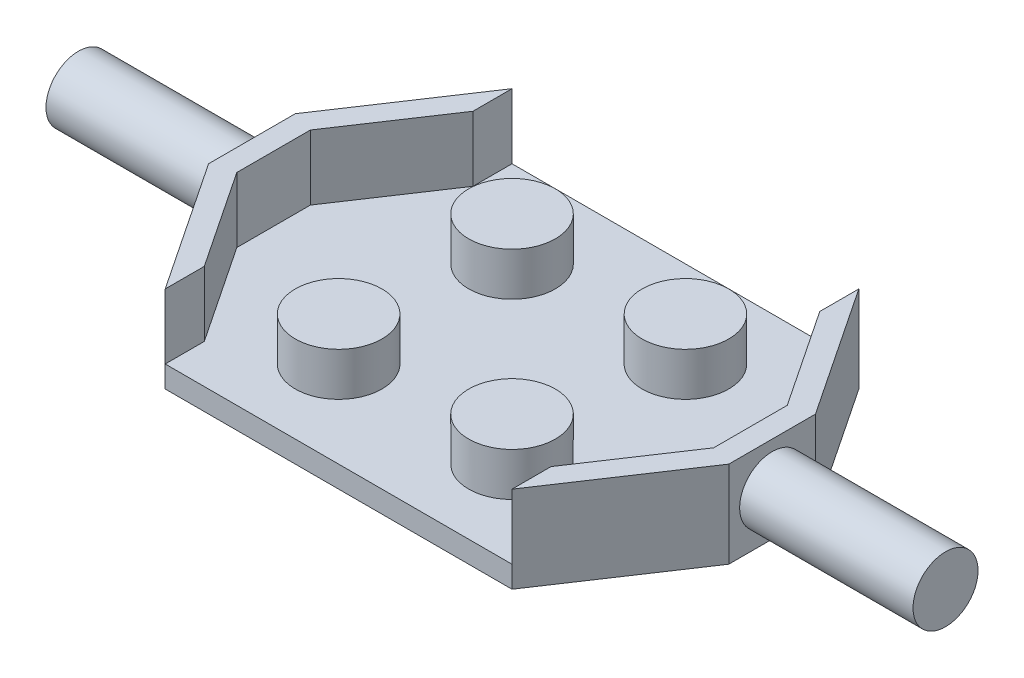
from build123d import *

# Parameters (mm, degrees)
BOSS_EXTRUDE1_DEPTH = 1
SKETCH2_R           = 2
BOSS_EXTRUDE2_DEPTH = 2
BOSS_EXTRUDE3_DEPTH = 3
SKETCH4_R           = 1.5
BOSS_EXTRUDE4_DEPTH = 8


with BuildPart() as part:
    # Sketch1 → Boss-Extrude1 (new body)
    with BuildSketch(Plane(origin=(0, 0, 0), x_dir=(1, 0, 0), z_dir=(0, 1, 0))):
        Polygon((-12, -2), (-12, 2), (-8, 8), (0, 8), (0, -8), (-8, -8), align=None)
    boss_extrude1 = extrude(amount=BOSS_EXTRUDE1_DEPTH)

    # Sketch2 → Boss-Extrude2 (add)
    with BuildSketch(Plane(origin=(0, 1, 0), x_dir=(1, 0, 0), z_dir=(0, 1, 0))):
        with Locations(Location((-4, 4, 0), (0, 0, 270))):
            Circle(SKETCH2_R)
        with Locations(Location((-4, -4, 0), (0, 0, 90))):
            Circle(SKETCH2_R)
    boss_extrude2 = extrude(amount=BOSS_EXTRUDE2_DEPTH)

    # Sketch3 → Boss-Extrude3 (add)
    with BuildSketch(Plane(origin=(0, 1, 0), x_dir=(1, 0, 0), z_dir=(0, 1, 0))):
        Polygon((-12, -2), (-8, -8), (-8, -6.197224362), (-11, -1.697224362), (-11, 1.697224362), (-8, 6.197224362), (-8, 8), (-12, 2), align=None)
    boss_extrude3 = extrude(amount=BOSS_EXTRUDE3_DEPTH)

    # Sketch4 → Boss-Extrude4 (add)
    with BuildSketch(Plane.ZY.offset(12)):
        with Locations((0, 2)):
            Circle(SKETCH4_R)
    boss_extrude4 = extrude(amount=BOSS_EXTRUDE4_DEPTH)

    # Mirror1: Boss-Extrude1, Boss-Extrude2, Boss-Extrude3, Boss-Extrude4 across plane
    add(boss_extrude1.mirror(Plane(origin=(0, 0, 0), x_dir=(0, 0, 1), z_dir=(1, 0, 0))))
    add(boss_extrude2.mirror(Plane(origin=(0, 0, 0), x_dir=(0, 0, 1), z_dir=(1, 0, 0))))
    add(boss_extrude3.mirror(Plane(origin=(0, 0, 0), x_dir=(0, 0, 1), z_dir=(1, 0, 0))))
    add(boss_extrude4.mirror(Plane(origin=(0, 0, 0), x_dir=(0, 0, 1), z_dir=(1, 0, 0))))


solid = part.part
